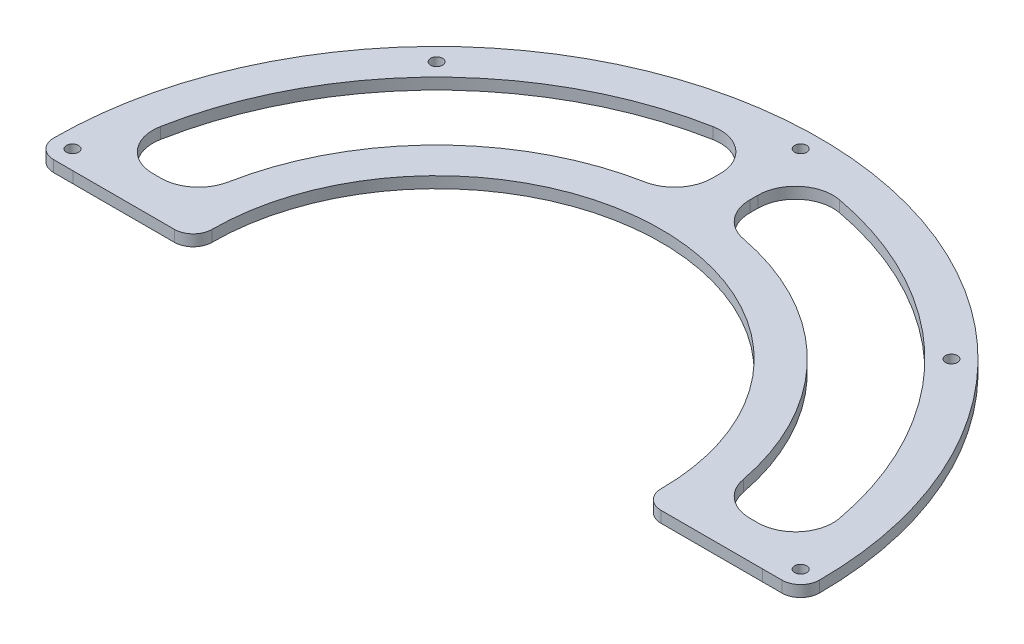
from build123d import *

# Parameters (mm, degrees)
SKETCH_1_R      = 1.6
EXTRUDE_1_DEPTH = 3
FILLET_1_R      = 5
FILLET_2_R      = 5


with BuildPart() as part:
    # 草图1 → 凸台-拉伸1 (new body)
    with BuildSketch(Plane(origin=(0, 0, 0), x_dir=(1, 0, 0), z_dir=(0, 1, 0))):
        with BuildLine():
            Line((-91.763881784, -5), (-64.576721038, -5))
            Line((-64.576721038, -5), (-59.560497815, -5))
            ThreePointArc((-59.560497815, -5), (0, 59.77), (59.560497815, -5))
            Line((59.560497815, -5), (64.576721038, -5))
            Line((64.576721038, -5), (91.763881784, -5))
            Line((91.763881784, -5), (101.777551781, -4.993991746))
            ThreePointArc((101.777551781, -4.993991746), (0, 101.9), (-101.777551781, -4.993991746))
            Line((-101.777551781, -4.993991746), (-91.763881784, -5))
        make_face()
        with Locations(Location((-96.9, 0, 0), (0, 0, 270))):
            Circle(SKETCH_1_R, mode=Mode.SUBTRACT)
        with Locations(Location((96.9, 0, 0), (0, 0, 270))):
            Circle(SKETCH_1_R, mode=Mode.SUBTRACT)
        with BuildLine():
            Line((-78.347003133, 5), (-80.514657051, 5))
            ThreePointArc((-80.514657051, 5), (-88.206048938, 8.609186997), (-90.345506507, 16.831501832))
            ThreePointArc((-90.345506507, 16.831501832), (-64.983113191, 64.983113191), (-16.831501832, 90.345506507))
            ThreePointArc((-16.831501832, 90.345506507), (-8.609186997, 88.206048938), (-5, 80.514657051))
            Line((-5, 80.514657051), (-5, 78.347003133))
            ThreePointArc((-5, 78.347003133), (-7.292728703, 71.975349568), (-13.119593832, 68.525390606))
            ThreePointArc((-13.119593832, 68.525390606), (-49.334840123, 49.334840123), (-68.525390606, 13.119593832))
            ThreePointArc((-68.525390606, 13.119593832), (-71.975349568, 7.292728703), (-78.347003133, 5))
        make_face(mode=Mode.SUBTRACT)
        with Locations(Location((-68.518647097, 68.518647097, 0), (0, 0, 270))):
            Circle(SKETCH_1_R, mode=Mode.SUBTRACT)
        with BuildLine():
            ThreePointArc((5, 80.514657051), (8.609186997, 88.206048938), (16.831501831, 90.345506507))
            ThreePointArc((16.831501831, 90.345506507), (64.983113191, 64.983113191), (90.345506507, 16.831501832))
            ThreePointArc((90.345506507, 16.831501832), (88.206048938, 8.609186997), (80.514657051, 5))
            Line((80.514657051, 5), (78.347003133, 5))
            ThreePointArc((78.347003133, 5), (71.975349568, 7.292728703), (68.525390606, 13.119593832))
            ThreePointArc((68.525390606, 13.119593832), (49.334840123, 49.334840123), (13.119593832, 68.525390606))
            ThreePointArc((13.119593832, 68.525390606), (7.292728703, 71.975349568), (5, 78.347003133))
            Line((5, 78.347003133), (5, 80.514657051))
        make_face(mode=Mode.SUBTRACT)
        with Locations(Location((0, 96.9, 0), (0, 0, 270))):
            Circle(SKETCH_1_R, mode=Mode.SUBTRACT)
        with Locations(Location((68.518647097, 68.518647097, 0), (0, 0, 270))):
            Circle(SKETCH_1_R, mode=Mode.SUBTRACT)
    extrude(amount=EXTRUDE_1_DEPTH)

    # 圆角1
    fillet_1_edges = [part.edges().sort_by_distance(p)[0] for p in [
        (-101.777551781, 1.5, 4.993991746),
        (101.777551781, 1.5, 4.993991746),
    ]]
    fillet(fillet_1_edges, radius=FILLET_1_R)

    # 圆角2
    fillet_2_edges = [part.edges().sort_by_distance(p)[0] for p in [
        (-59.560497815, 1.5, 5),
        (59.560497815, 1.5, 5),
    ]]
    fillet(fillet_2_edges, radius=FILLET_2_R)


solid = part.part
